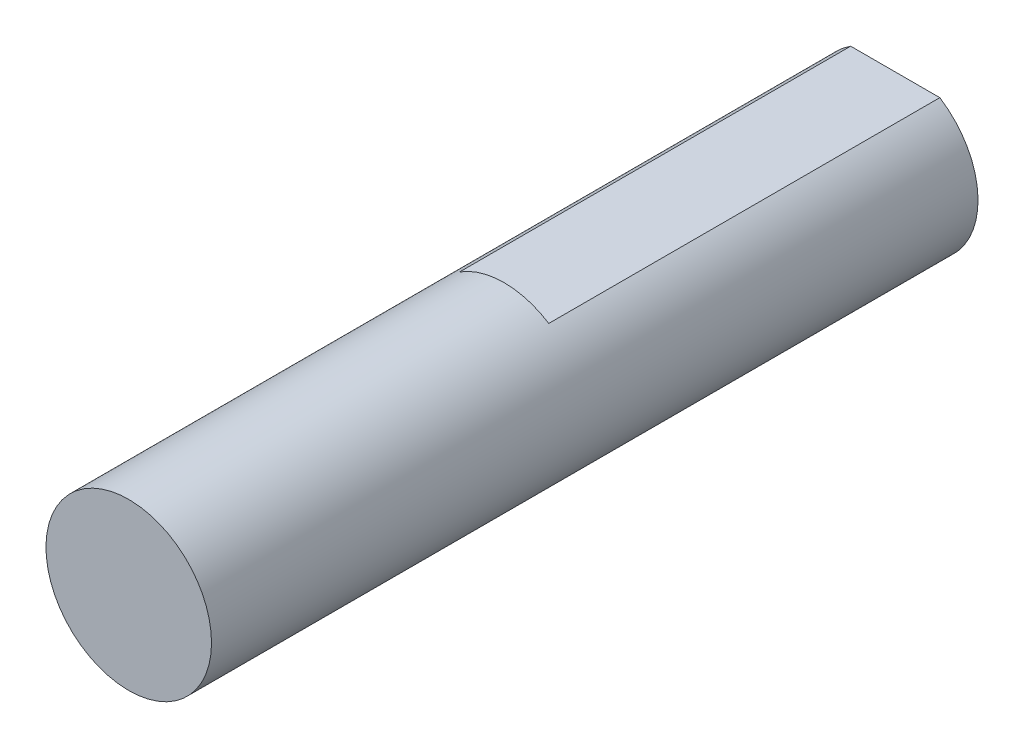
from build123d import *

# Parameters (mm, degrees)
SKETCH1_R           = 3.175
BOSS_EXTRUDE1_DEPTH = 29.4
CUT_EXTRUDE1_DEPTH  = 15


with BuildPart() as part:
    # Sketch1 → Boss-Extrude1 (new body)
    with BuildSketch(Plane.XY):
        Circle(SKETCH1_R)
    extrude(amount=BOSS_EXTRUDE1_DEPTH)

    # Sketch1<3> → Cut-Extrude1 (cut)
    with BuildSketch(Plane.XY):
        with BuildLine():
            Line((-1.710263138, 2.675), (0, 2.675))
            Line((0, 2.675), (1.710263138, 2.675))
            ThreePointArc((1.710263138, 2.675), (0, 3.175), (-1.710263138, 2.675))
        make_face()
    extrude(amount=CUT_EXTRUDE1_DEPTH, mode=Mode.SUBTRACT)


solid = part.part
